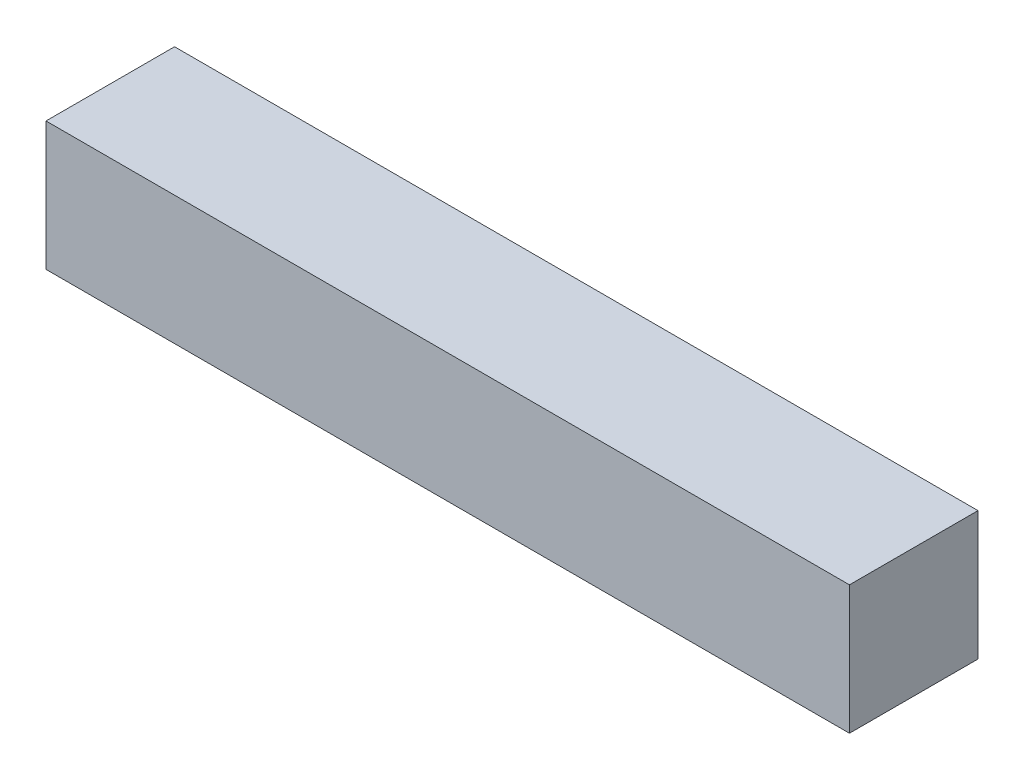
from build123d import *

# Parameters (mm, degrees)
SKETCH1_W           = 40
SKETCH1_H           = 40
BOSS_EXTRUDE1_DEPTH = 250


with BuildPart() as part:
    # Sketch1 → Boss-Extrude1 (new body)
    with BuildSketch(Plane(origin=(0, 0, 0), x_dir=(0, 0, -1), z_dir=(1, 0, 0))):
        Rectangle(SKETCH1_W, SKETCH1_H)
    extrude(amount=BOSS_EXTRUDE1_DEPTH)


solid = part.part
